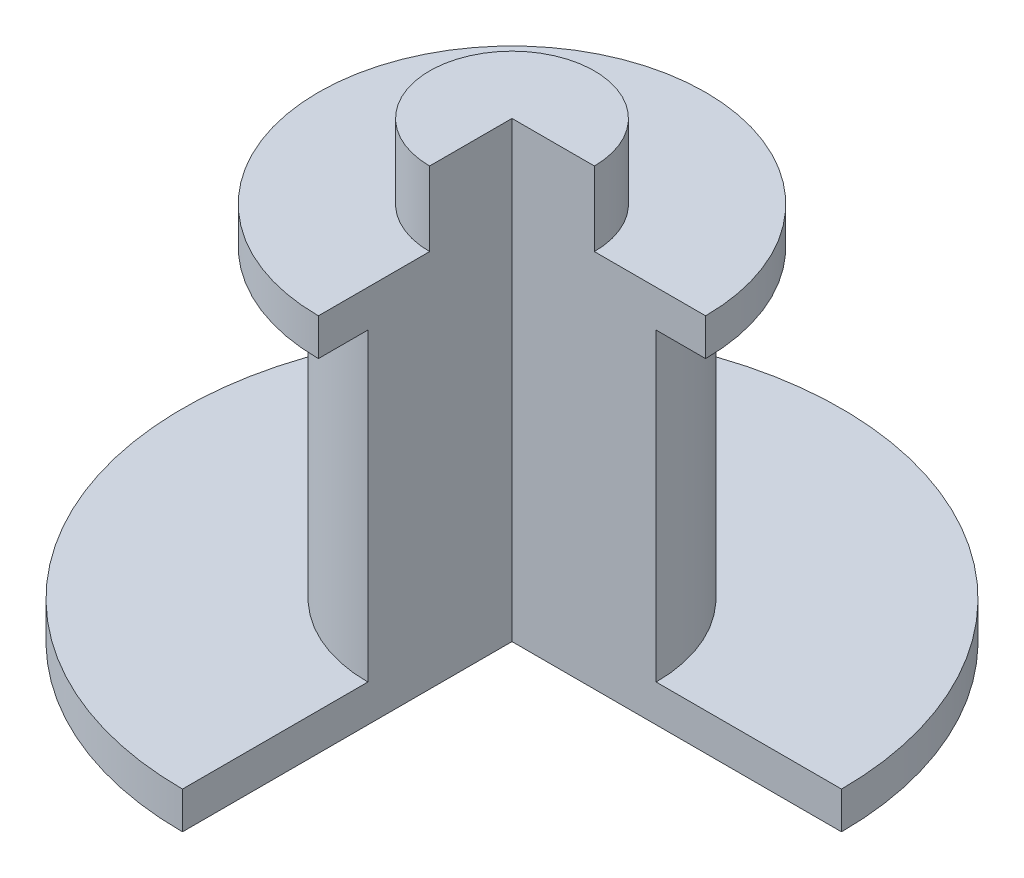
from build123d import *

# Parameters (mm, degrees)
REVOLVE1_ANGLE           = 180
REVOLVE1_OTHER_WAY_ANGLE = 90


with BuildPart() as part:
    # Sketch1 → Revolve1 (revolve)
    with BuildSketch(Plane.XY):
        Polygon((0, 0), (-80, 0), (-80, 9), (-35, 9), (-35, 83), (-47, 83), (-47, 92), (-20, 92), (-20, 110), (0, 110), align=None)
    revolve(axis=Axis((0, 0, 0), (0, -1, 0)), revolution_arc=REVOLVE1_ANGLE)

    # Sketch1 → Revolve1 other way (revolve)
    with BuildSketch(Plane.XY):
        Polygon((0, 0), (-80, 0), (-80, 9), (-35, 9), (-35, 83), (-47, 83), (-47, 92), (-20, 92), (-20, 110), (0, 110), align=None)
    revolve(axis=Axis((0, 0, 0), (0, 1, 0)), revolution_arc=REVOLVE1_OTHER_WAY_ANGLE)


solid = part.part
